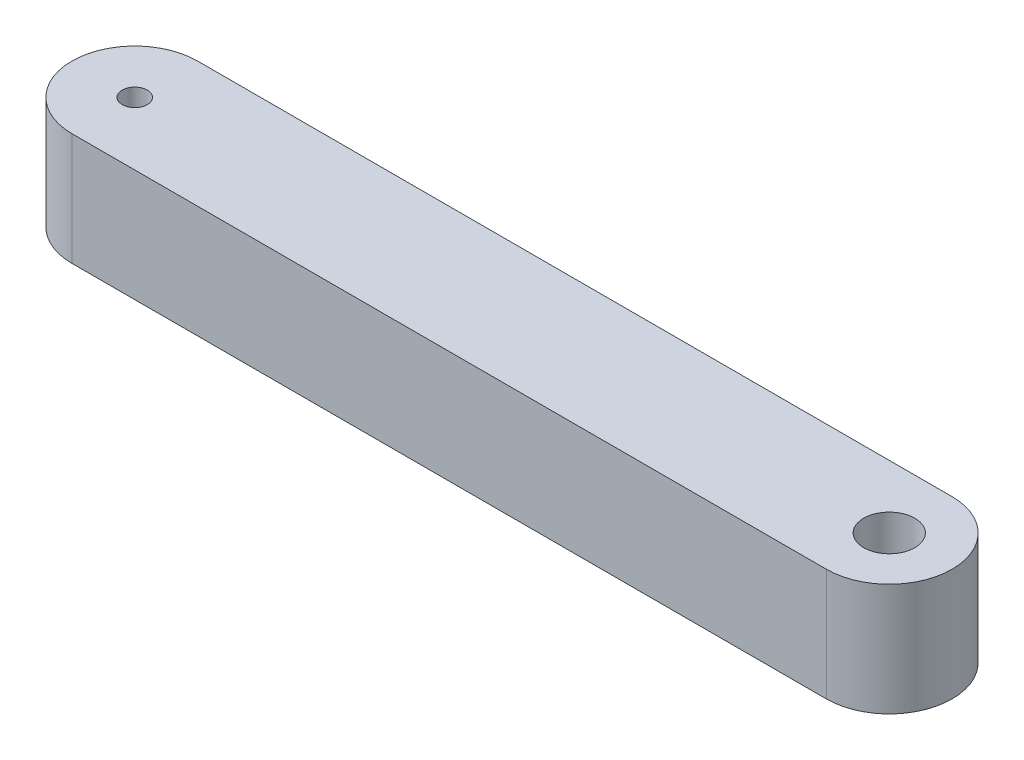
from build123d import *

# Parameters (mm, degrees)
SKETCH1_R           = 3
BOSS_EXTRUDE2_DEPTH = 26.8
SKETCH2_R           = 6.1
CUT_EXTRUDE1_DEPTH  = 26.8
SKETCH3_R           = 6.5
CUT_EXTRUDE2_DEPTH  = 5


with BuildPart() as part:
    # Sketch1 → Boss-Extrude2 (new body)
    with BuildSketch(Plane(origin=(0, 0, 0), x_dir=(1, 0, 0), z_dir=(0, 1, 0))):
        with BuildLine():
            Line((-90, -15), (90, -15))
            ThreePointArc((90, -15), (105, 0), (90, 15))
            Line((90, 15), (-90, 15))
            ThreePointArc((-90, 15), (-105, 0), (-90, -15))
        make_face()
        with Locations(Location((-90, 0, 0), (0, 0, 270))):
            Circle(SKETCH1_R, mode=Mode.SUBTRACT)
        with Locations(Location((90, 0, 0), (0, 0, 270))):
            Circle(SKETCH1_R, mode=Mode.SUBTRACT)
    extrude(amount=BOSS_EXTRUDE2_DEPTH)

    # Sketch2 → Cut-Extrude1 (cut)
    with BuildSketch(Plane.XZ):
        with Locations(Location((90, 0, 0), (0, 0, 270))):
            Circle(SKETCH2_R)
    extrude(amount=-CUT_EXTRUDE1_DEPTH, mode=Mode.SUBTRACT)

    # Sketch3 → Cut-Extrude2 (cut)
    with BuildSketch(Plane.XZ):
        with Locations(Location((90, 0, 0), (0, 0, 270))):
            Circle(SKETCH3_R)
    extrude(amount=-CUT_EXTRUDE2_DEPTH, mode=Mode.SUBTRACT)


solid = part.part
